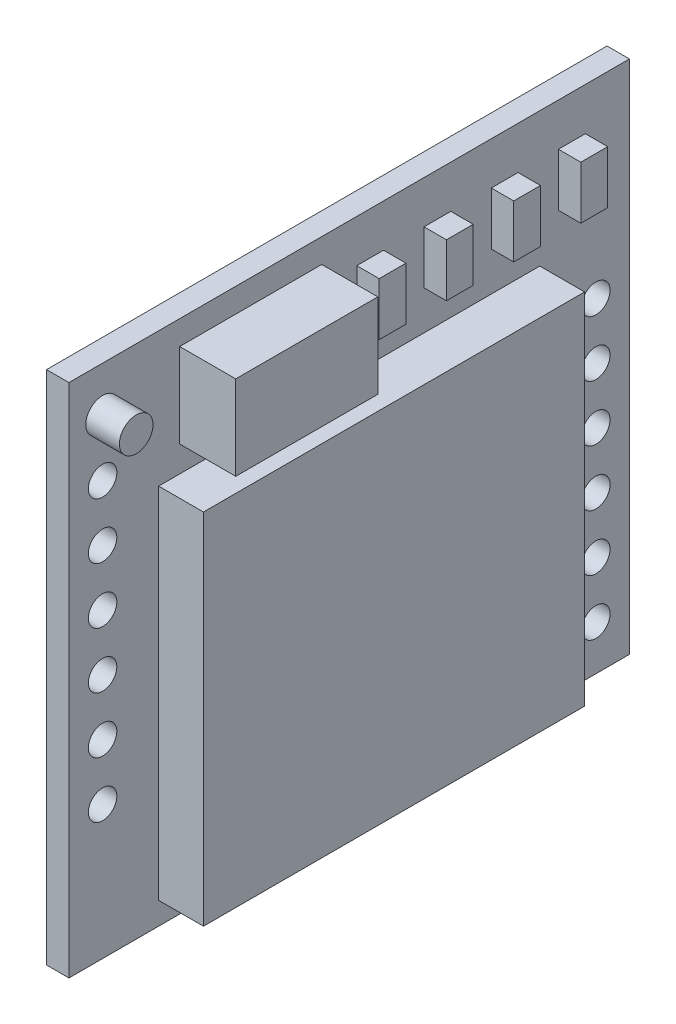
from build123d import *

# Parameters (mm, degrees)
SKETCH1_W           = 25
SKETCH1_H           = 23
BOSS_EXTRUDE1_DEPTH = 1
SKETCH2_W           = 17
SKETCH2_H           = 16
BOSS_EXTRUDE2_DEPTH = 2
SKETCH3_W           = 6.336645523
SKETCH3_H           = 3.765253137
BOSS_EXTRUDE3_DEPTH = 2.5
SKETCH4_W           = 1.193860751
SKETCH4_H           = 2.357109687
BOSS_EXTRUDE4_DEPTH = 1
SKETCH5_W           = 1.2
SKETCH5_H           = 2.357109687
BOSS_EXTRUDE5_DEPTH = 1
SKETCH6_R           = 0.75
BOSS_EXTRUDE6_DEPTH = 1.5
SKETCH7_R           = 0.635
CUT_EXTRUDE1_DEPTH  = 1.5
SKETCH8_W           = 15
SKETCH8_H           = 17.5
BOSS_EXTRUDE7_DEPTH = 2


with BuildPart() as part:
    # Sketch1 → Boss-Extrude1 (new body)
    with BuildSketch(Plane(origin=(0, 0, 0), x_dir=(0, 0, -1), z_dir=(1, 0, 0))):
        with Locations((12.5, -11.5)):
            Rectangle(SKETCH1_W, SKETCH1_H)
    extrude(amount=BOSS_EXTRUDE1_DEPTH)

    # Sketch2 → Boss-Extrude2 (add)
    with BuildSketch(Plane(origin=(1, 0, 0), x_dir=(0, 0, -1), z_dir=(1, 0, 0))):
        with Locations((12.5, -14)):
            Rectangle(SKETCH2_W, SKETCH2_H)
    extrude(amount=BOSS_EXTRUDE2_DEPTH)

    # Sketch3 → Boss-Extrude3 (add)
    with BuildSketch(Plane(origin=(1, 0, 0), x_dir=(0, 0, -1), z_dir=(1, 0, 0))):
        with Locations((8.107204674, -2.95930386)):
            Rectangle(SKETCH3_W, SKETCH3_H)
    extrude(amount=BOSS_EXTRUDE3_DEPTH)

    # Sketch4 → Boss-Extrude4 (add)
    with BuildSketch(Plane(origin=(1, 0, 0), x_dir=(0, 0, -1), z_dir=(1, 0, 0))):
        with Locations((16.433660331, -3.081751116)):
            Rectangle(SKETCH4_W, SKETCH4_H)
        with Locations((13.433660331, -3.081751116)):
            Rectangle(SKETCH4_W, SKETCH4_H)
        with Locations((19.433660331, -3.081751116)):
            Rectangle(SKETCH4_W, SKETCH4_H)
    extrude(amount=BOSS_EXTRUDE4_DEPTH)

    # Sketch5 → Boss-Extrude5 (add)
    with BuildSketch(Plane(origin=(1, 0, 0), x_dir=(0, 0, -1), z_dir=(1, 0, 0))):
        with Locations((22.430590706, -3.081751116)):
            Rectangle(SKETCH5_W, SKETCH5_H)
    extrude(amount=BOSS_EXTRUDE5_DEPTH)

    # Sketch6 → Boss-Extrude6 (add)
    with BuildSketch(Plane(origin=(1, 0, 0), x_dir=(0, 0, -1), z_dir=(1, 0, 0))):
        with Locations((1.5, -2)):
            Circle(SKETCH6_R)
    extrude(amount=BOSS_EXTRUDE6_DEPTH)

    # Sketch7 → Cut-Extrude1 (cut)
    with BuildSketch(Plane(origin=(1, 0, 0), x_dir=(0, 0, -1), z_dir=(1, 0, 0))):
        with Locations((1.5, -4.54)):
            Circle(SKETCH7_R)
        with Locations((1.5, -7.04)):
            Circle(SKETCH7_R)
        with Locations((1.5, -9.54)):
            Circle(SKETCH7_R)
        with Locations((1.5, -12.04)):
            Circle(SKETCH7_R)
        with Locations((1.5, -14.54)):
            Circle(SKETCH7_R)
        with Locations((1.5, -17.04)):
            Circle(SKETCH7_R)
        with Locations((23.5, -21)):
            Circle(SKETCH7_R)
        with Locations((23.5, -18.5)):
            Circle(SKETCH7_R)
        with Locations((23.5, -16)):
            Circle(SKETCH7_R)
        with Locations((23.5, -13.5)):
            Circle(SKETCH7_R)
        with Locations((23.5, -11)):
            Circle(SKETCH7_R)
        with Locations((23.5, -8.5)):
            Circle(SKETCH7_R)
    extrude(amount=-CUT_EXTRUDE1_DEPTH, mode=Mode.SUBTRACT)

    # Sketch8 → Boss-Extrude7 (add)
    with BuildSketch(Plane.ZY):
        with Locations((-12.5, -13.75)):
            Rectangle(SKETCH8_W, SKETCH8_H)
    extrude(amount=BOSS_EXTRUDE7_DEPTH)


solid = part.part
